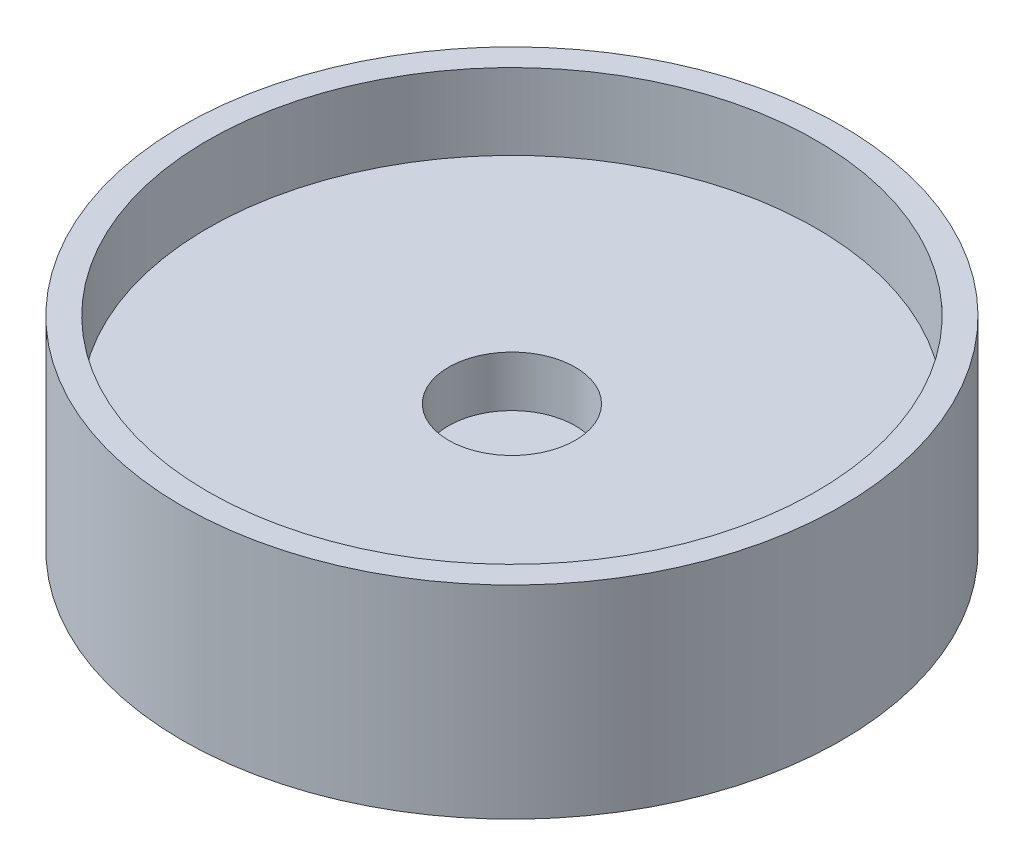
from build123d import *

# Parameters (mm, degrees)
SKETCH_1_R          = 13
EXTRUDE_1_DEPTH     = 8
SKETCH_2_R          = 12
CUT_EXTRUDE_1_DEPTH = 3
SKETCH_3_R          = 2.5
CUT_EXTRUDE_2_DEPTH = 2


with BuildPart() as part:
    # 草图1 → 凸台-拉伸1 (new body)
    with BuildSketch(Plane(origin=(0, 0, 0), x_dir=(1, 0, 0), z_dir=(0, 1, 0))):
        with Locations(Location((0, 0, 0), (0, 0, 270))):
            Circle(SKETCH_1_R)
    extrude(amount=EXTRUDE_1_DEPTH)

    # 草图2 → 切除-拉伸1 (cut)
    with BuildSketch(Plane(origin=(0, 8, 0), x_dir=(1, 0, 0), z_dir=(0, 1, 0))):
        with Locations(Location((0, 0, 0), (0, 0, 270))):
            Circle(SKETCH_2_R)
    extrude(amount=-CUT_EXTRUDE_1_DEPTH, mode=Mode.SUBTRACT)

    # 草图3 → 切除-拉伸2 (cut)
    with BuildSketch(Plane(origin=(0, 5, 0), x_dir=(1, 0, 0), z_dir=(0, 1, 0))):
        with Locations(Location((0, 0, 0), (0, 0, 270))):
            Circle(SKETCH_3_R)
    extrude(amount=-CUT_EXTRUDE_2_DEPTH, mode=Mode.SUBTRACT)


solid = part.part
